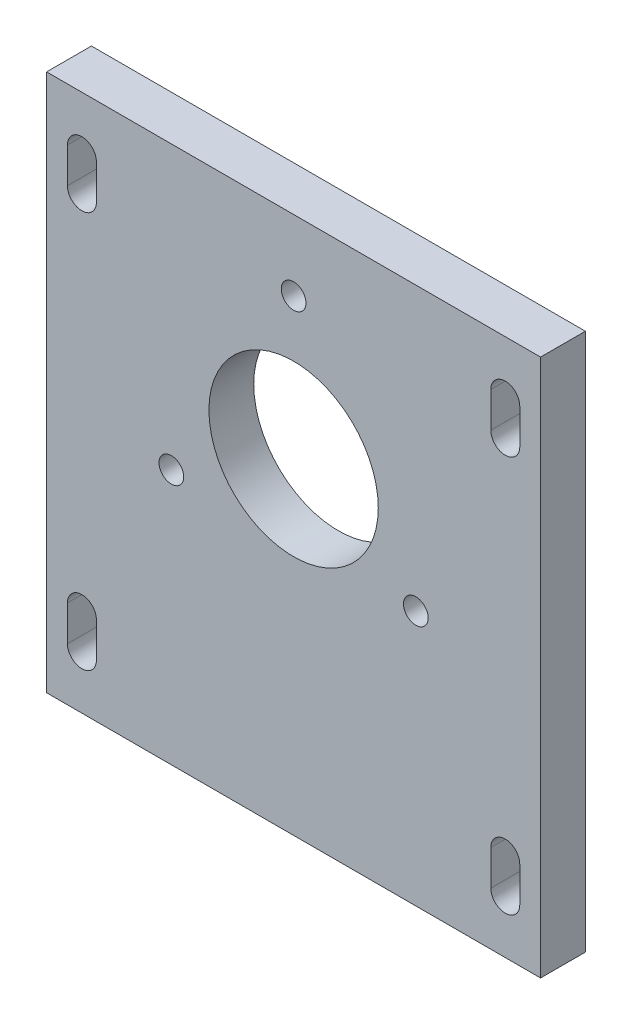
from build123d import *

# Parameters (mm, degrees)
SKETCH1_W           = 70
SKETCH1_H           = 76.2
SKETCH1_R           = 1.75
SKETCH1_R_2         = 12
BOSS_EXTRUDE1_DEPTH = 6.35


with BuildPart() as part:
    # Sketch1 → Boss-Extrude1 (new body)
    with BuildSketch(Plane.XY):
        Rectangle(SKETCH1_W, SKETCH1_H)
        with Locations((0, 28.1)):
            Circle(SKETCH1_R, mode=Mode.SUBTRACT)
        with Locations((17.320508076, -1.9)):
            Circle(SKETCH1_R, mode=Mode.SUBTRACT)
        with Locations((-17.320508076, -1.9)):
            Circle(SKETCH1_R, mode=Mode.SUBTRACT)
        with Locations((0, 8.1)):
            Circle(SKETCH1_R_2, mode=Mode.SUBTRACT)
        with BuildLine():
            Line((-32.05, 25.6), (-32.05, 30.6))
            ThreePointArc((-32.05, 30.6), (-30, 32.65), (-27.95, 30.6))
            Line((-27.95, 30.6), (-27.95, 25.6))
            ThreePointArc((-27.95, 25.6), (-30, 23.55), (-32.05, 25.6))
        make_face(mode=Mode.SUBTRACT)
        with BuildLine():
            Line((32.05, 25.6), (32.05, 30.6))
            ThreePointArc((32.05, 30.6), (30, 32.65), (27.95, 30.6))
            Line((27.95, 30.6), (27.95, 25.6))
            ThreePointArc((27.95, 25.6), (30, 23.55), (32.05, 25.6))
        make_face(mode=Mode.SUBTRACT)
        with BuildLine():
            Line((-32.05, -25.6), (-32.05, -30.6))
            ThreePointArc((-32.05, -30.6), (-30, -32.65), (-27.95, -30.6))
            Line((-27.95, -30.6), (-27.95, -25.6))
            ThreePointArc((-27.95, -25.6), (-30, -23.55), (-32.05, -25.6))
        make_face(mode=Mode.SUBTRACT)
        with BuildLine():
            Line((32.05, -25.6), (32.05, -30.6))
            ThreePointArc((32.05, -30.6), (30, -32.65), (27.95, -30.6))
            Line((27.95, -30.6), (27.95, -25.6))
            ThreePointArc((27.95, -25.6), (30, -23.55), (32.05, -25.6))
        make_face(mode=Mode.SUBTRACT)
    extrude(amount=BOSS_EXTRUDE1_DEPTH)


solid = part.part
